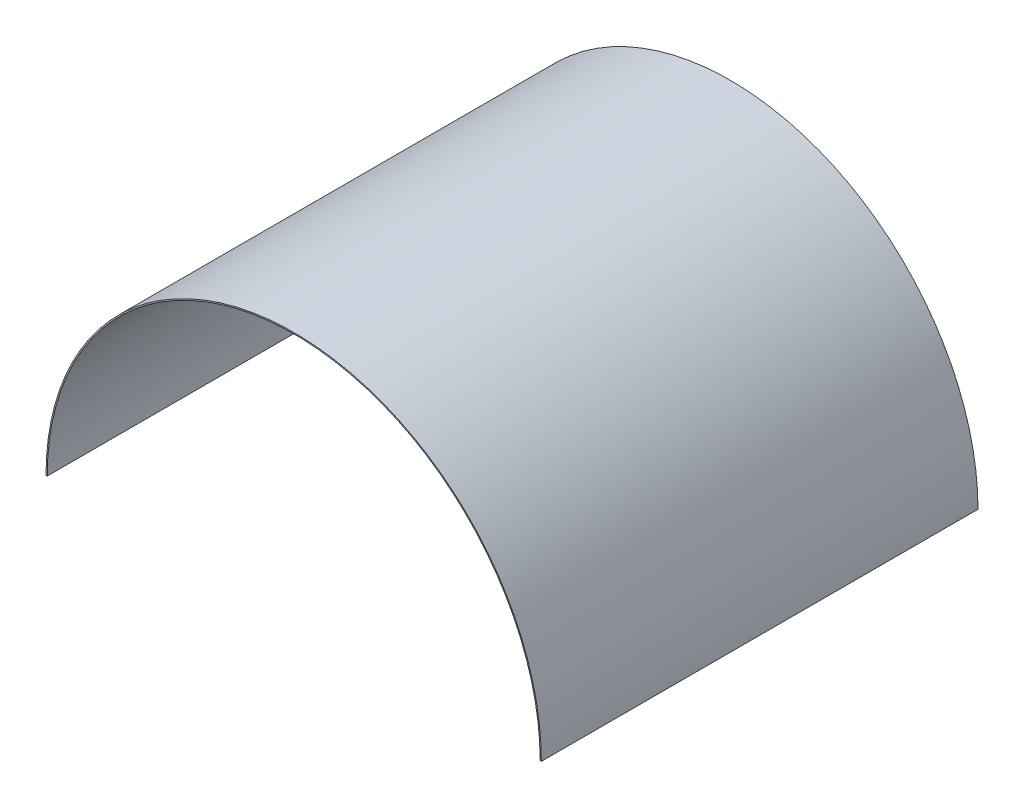
from build123d import *

# Parameters (mm, degrees)
EXTRUDE_THIN1_DEPTH = 360


with BuildPart() as part:
    # Sketch1 → Extrude-Thin1 (new body)
    with BuildSketch(Plane.XY):
        with BuildLine():
            ThreePointArc((203.2, 0), (0, 203.2), (-203.2, 0))
            Line((-203.2, 0), (-204.2, 0))
            ThreePointArc((-204.2, 0), (0, 204.2), (204.2, 0))
            Line((204.2, 0), (203.2, 0))
        make_face()
    extrude(amount=EXTRUDE_THIN1_DEPTH)


solid = part.part
